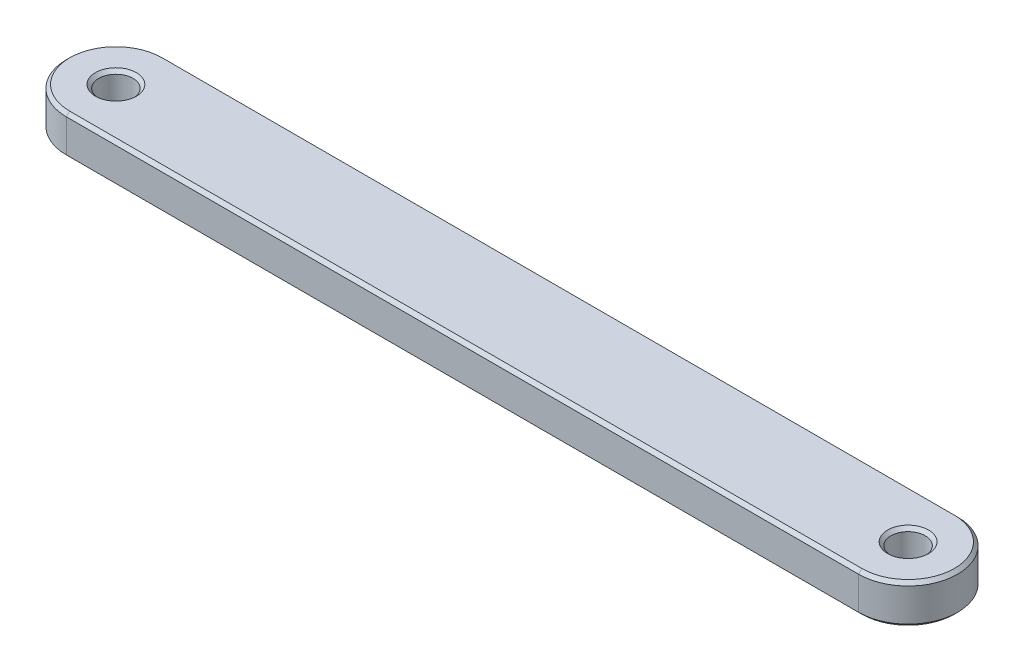
from build123d import *

# Parameters (mm, degrees)
SKETCH1_R           = 2.6
BOSS_EXTRUDE1_DEPTH = 3
CHAMFER1_SIZE       = 0.5


with BuildPart() as part:
    # Sketch1 → Boss-Extrude1 (new, symmetric)
    with BuildSketch(Plane(origin=(0, 0, 0), x_dir=(1, 0, 0), z_dir=(0, 1, 0))):
        with BuildLine():
            Line((0, -7.5), (120, -7.5))
            ThreePointArc((120, -7.5), (127.5, 0), (120, 7.5))
            Line((120, 7.5), (0, 7.5))
            ThreePointArc((0, 7.5), (-7.5, 0), (0, -7.5))
        make_face()
        with Locations(Location((0, 0, 0), (0, 0, 270))):
            Circle(SKETCH1_R, mode=Mode.SUBTRACT)
        with Locations(Location((120, 0, 0), (0, 0, 270))):
            Circle(SKETCH1_R, mode=Mode.SUBTRACT)
    extrude(amount=BOSS_EXTRUDE1_DEPTH, both=True)

    # Chamfer1
    chamfer1_edges = [part.edges().sort_by_distance(p)[0] for p in [
        (120, -3, -2.6),
        (0, -3, -2.6),
        (120, 3, -2.6),
        (60, 3, 7.5),
        (127.5, 3, 0),
        (60, 3, -7.5),
        (-7.5, 3, 0),
        (0, 3, -2.6),
        (-7.5, -3, 0),
        (60, -3, -7.5),
        (127.5, -3, 0),
        (60, -3, 7.5),
    ]]
    chamfer(chamfer1_edges, length=CHAMFER1_SIZE)


solid = part.part
